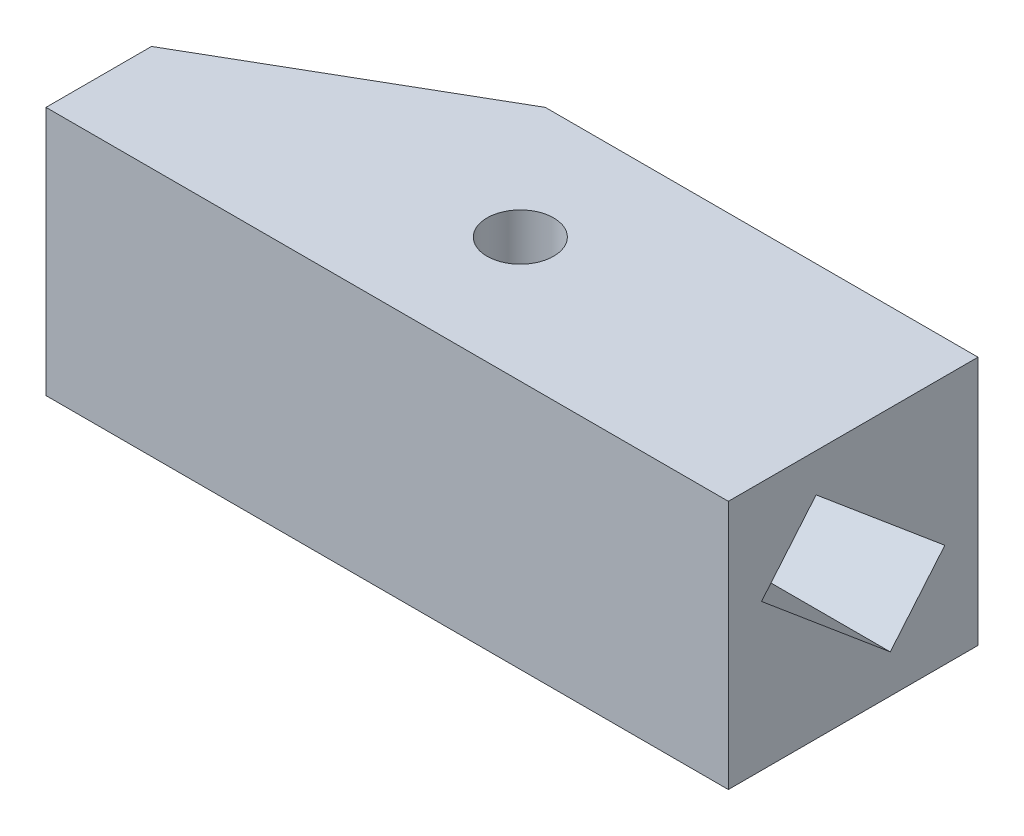
from build123d import *

# Parameters (mm, degrees)
EXTRUDE_1_DEPTH     = 30
SKETCH_2_R          = 4
CUT_EXTRUDE_1_DEPTH = 49.476798574
CUT_EXTRUDE_4_DEPTH = 25
SKETCH1_W           = 30
SKETCH1_H           = 30
BOSS_EXTRUDE1_DEPTH = 27
CHAMFER1_SIZE       = 30
CHAMFER1_SIZE2      = 17.320508076


with BuildPart() as part:
    # Эскиз1 → Бобышка-Вытянуть1 (new body)
    with BuildSketch(Plane(origin=(0, 0, 0), x_dir=(1, 0, 0), z_dir=(0, 1, 0))):
        Polygon((-20, -15), (-35, -15), (-35, 15), (-20, 15), (20, 15), (20, -15), align=None)
    extrude(amount=EXTRUDE_1_DEPTH)

    # Эскиз2 → Вырез-Вытянуть1 (cut, through all)
    with BuildSketch(Plane(origin=(0, 30, 0), x_dir=(1, 0, 0), z_dir=(0, 1, 0))):
        with Locations(Location((-20, 0, 0), (0, 0, 270))):
            Circle(SKETCH_2_R)
    extrude(amount=-CUT_EXTRUDE_1_DEPTH, mode=Mode.SUBTRACT)

    # Эскиз5 → Вырез-Вытянуть4 (cut)
    with BuildSketch(Plane(origin=(20, 0, 0), x_dir=(0, 0, -1), z_dir=(1, 0, 0))):
        Polygon((4.458832066, 4.601018482), (11.015265685, 12.414671802), (-4.458832066, 25.398981518), (-11.015265685, 17.585328198), align=None)
    extrude(amount=-CUT_EXTRUDE_4_DEPTH, mode=Mode.SUBTRACT)

    # Sketch1 → Boss-Extrude1 (add)
    with BuildSketch(Plane.ZY.offset(35)):
        with Locations((0, 15)):
            Rectangle(SKETCH1_W, SKETCH1_H)
    extrude(amount=BOSS_EXTRUDE1_DEPTH)

    # Chamfer1
    chamfer1_edges = [part.edges().sort_by_distance(p)[0] for p in [
        (-62, 15, -15),
    ]]
    chamfer1_side = [part.faces().sort_by_distance(p)[0] for p in [
        (-21, 15, -15),
    ]]
    chamfer(chamfer1_edges, length=CHAMFER1_SIZE, length2=CHAMFER1_SIZE2, reference=chamfer1_side[0])


solid = part.part
